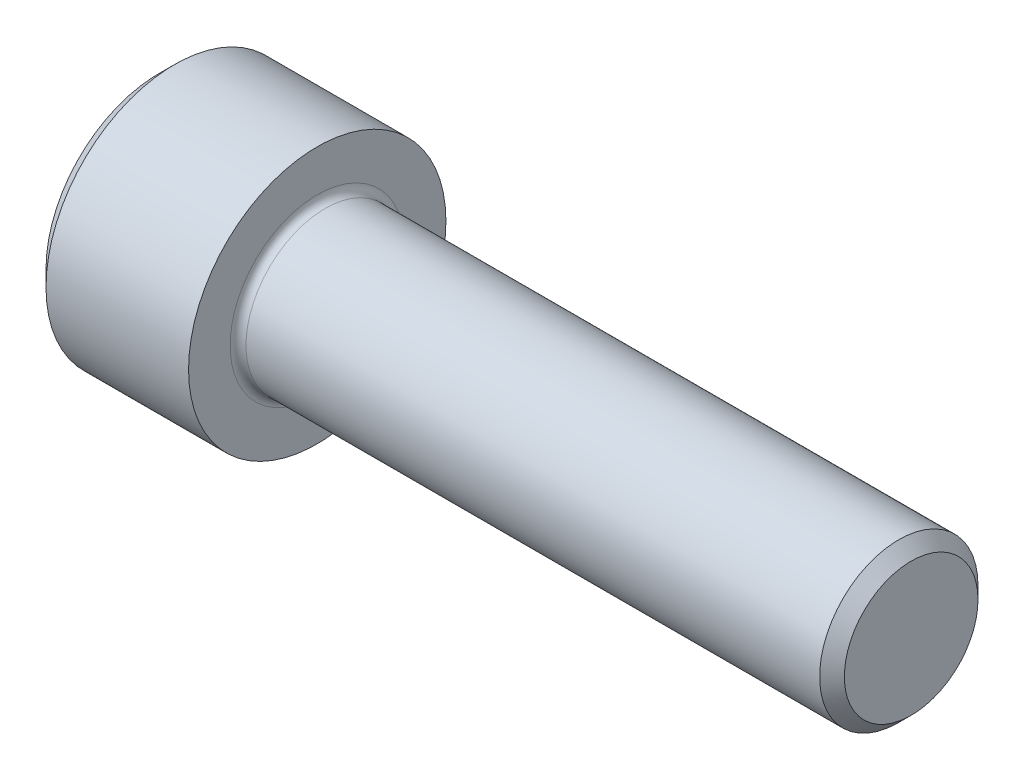
from build123d import *

# Parameters (mm, degrees)
CHAMFER1_SIZE      = 0.625
CUT_EXTRUDE1_DEPTH = 4
CHAMFER2_SIZE      = 0.8
FILLET1_R          = 0.4


with BuildPart() as part:
    # Sketch1 → Revolve1 (revolve)
    with BuildSketch(Plane(origin=(0, 0, 0), x_dir=(1, 0, 0), z_dir=(0, 1, 0))):
        Polygon((0, 0), (0, 6.5), (8, 6.5), (8, 4), (38, 4), (38, 0), align=None)
    revolve(axis=Axis((38, 0, 0), (-1, 0, 0)))

    # Chamfer1
    chamfer1_edges = [part.edges().sort_by_distance(p)[0] for p in [
        (38, 0, 4),
    ]]
    chamfer(chamfer1_edges, length=CHAMFER1_SIZE)

    # Sketch3 → Cut-Revolve1 (revolve, cut)
    with BuildSketch(Plane(origin=(0, 0, 0), x_dir=(1, 0, 0), z_dir=(0, 1, 0)), mode=Mode.PRIVATE) as cut_revolve1_sk:
        Polygon((0, 0), (5.732050808, 0), (4, 3), (0, 3), align=None)
    revolve(cut_revolve1_sk.sketch.rotate(Axis((0, 0, 0), (1, 0, 0)), 180), axis=Axis((0, 0, 0), (1, 0, 0)), mode=Mode.SUBTRACT)

    # Sketch2 → Cut-Extrude1 (cut)
    with BuildSketch(Plane.ZY):
        Polygon((0, 3.464101615), (-3, 1.732050808), (-3, -1.732050808), (0, -3.464101615), (3, -1.732050808), (3, 1.732050808), align=None)
    extrude(amount=-CUT_EXTRUDE1_DEPTH, mode=Mode.SUBTRACT)

    # Chamfer2
    chamfer2_edges = [part.edges().sort_by_distance(p)[0] for p in [
        (0, 0, 6.5),
    ]]
    chamfer(chamfer2_edges, length=CHAMFER2_SIZE)

    # Fillet1
    fillet1_edges = [part.edges().sort_by_distance(p)[0] for p in [
        (8, 0, 4),
    ]]
    fillet(fillet1_edges, radius=FILLET1_R)


solid = part.part
